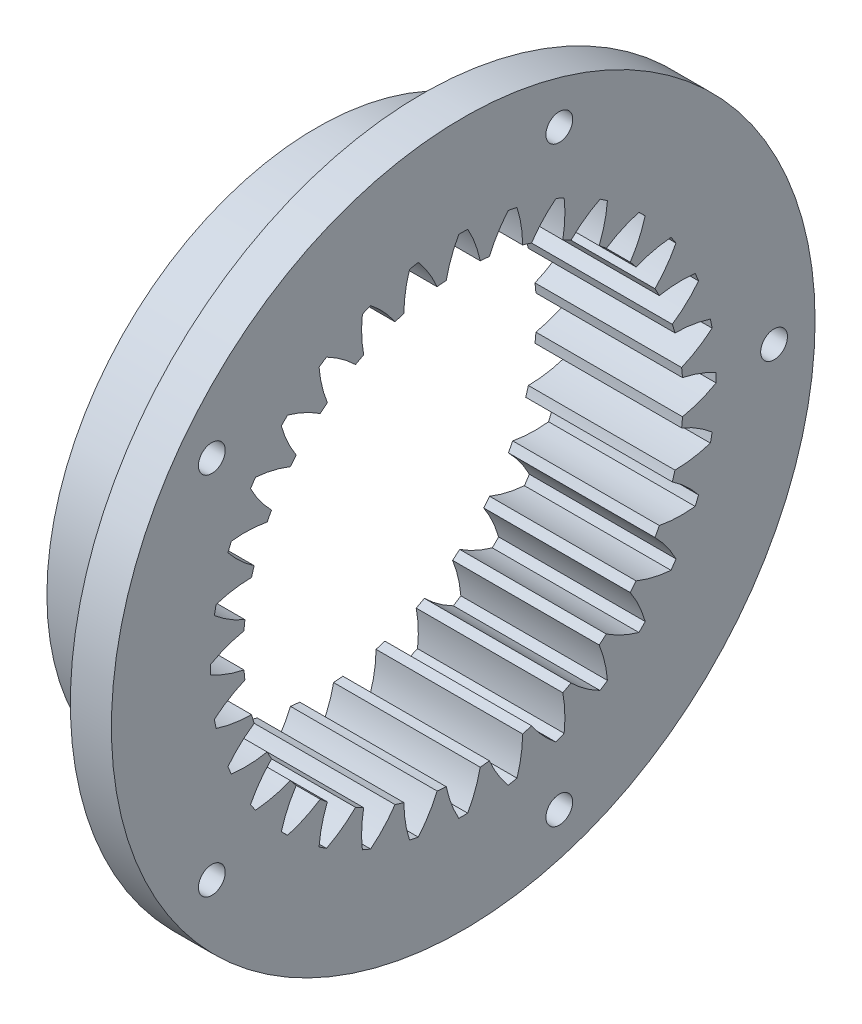
from build123d import *

# Parameters (mm, degrees)
BASPROSKE_W                             = 31.75
BASPROSKE_H                             = 7.17042
TOOTHCUT_DEPTH                          = 84.744484033
TEETHCUTS_COUNT                         = 32
TEETHCUTS_ANGLE                         = 348.75
BOSS_EXTRUDE2_START                     = 31.75
SKETCH1_R                               = 58.42
SKETCH1_R_2                             = 54.79542
BOSS_EXTRUDE2_DEPTH                     = 31.75
SKETCH3_R                               = 76.2
SKETCH3_R_2                             = 58.42
BOSS_EXTRUDE4_DEPTH                     = 8.89
CBORE_FOR_M5_HEX_HEAD_BOLT2_D           = 5.8
CBORE_FOR_M5_HEX_HEAD_BOLT2_CBORE_D     = 12.24
CBORE_FOR_M5_HEX_HEAD_BOLT2_CBORE_DEPTH = 3.58
CIRPATTERN1_COUNT                       = 5


with BuildPart() as part:
    # BasProSke → Base-Revolve (revolve)
    with BuildSketch(Plane(origin=(0, 0, 0), x_dir=(1, 0, 0), z_dir=(0, 1, 0)), mode=Mode.PRIVATE) as base_revolve_sk:
        with Locations((15.875, 51.21021)):
            Rectangle(BASPROSKE_W, BASPROSKE_H)
    revolve(base_revolve_sk.sketch.rotate(Axis((-10, 0, 0), (1, 0, 0)), 180), axis=Axis((-10, 0, 0), (1, 0, 0)))

    # TooCutSke → ToothCut (cut, through all)
    with BuildSketch(Plane(origin=(0, 0, 0), x_dir=(0, 0, -1), z_dir=(1, 0, 0))):
        with BuildLine():
            ThreePointArc((3.674109851, 47.457589877), (2.602534439, 51.213892195), (0.967674745, 54.761470911))
            ThreePointArc((0.967674745, 54.761470911), (0, 54.77002), (-0.967674745, 54.761470911))
            ThreePointArc((-0.967674745, 54.761470911), (-2.602534439, 51.213892195), (-3.674109851, 47.457589877))
            ThreePointArc((-3.674109851, 47.457589877), (0, 47.5996), (3.674109851, 47.457589877))
        make_face()
    toothcut = extrude(amount=TOOTHCUT_DEPTH, mode=Mode.SUBTRACT)

    # TeethCuts: ToothCut ×32 about axis
    teethcuts_axis = Axis((-10, 0, 0), (1, 0, 0))
    for i in range(1, TEETHCUTS_COUNT):
        add(toothcut.rotate(teethcuts_axis, i * TEETHCUTS_ANGLE / (TEETHCUTS_COUNT - 1)), mode=Mode.SUBTRACT)

    # Sketch1 → Boss-Extrude2 (add)
    with BuildSketch(Plane(origin=(0, 0, 0), x_dir=(0, 0, -1), z_dir=(1, 0, 0)).offset(BOSS_EXTRUDE2_START)):
        with Locations(Location((0, 0, 0), (0, 0, 180))):
            Circle(SKETCH1_R)
        Circle(SKETCH1_R_2, mode=Mode.SUBTRACT)
    extrude(amount=-BOSS_EXTRUDE2_DEPTH)

    # Sketch3 → Boss-Extrude4 (add)
    with BuildSketch(Plane(origin=(31.75, 0, 0), x_dir=(0, 0, -1), z_dir=(1, 0, 0))):
        Circle(SKETCH3_R)
        Circle(SKETCH3_R_2, mode=Mode.SUBTRACT)
    extrude(amount=-BOSS_EXTRUDE4_DEPTH)

    # CBORE for M5 Hex Head Bolt2 (through all)
    with Locations(Plane(origin=(22.86, 0, -67.31), x_dir=(0, 0, -1), z_dir=(-1, 0, 0))):
        with Locations((0, 0)):
            cbore_for_m5_hex_head_bolt2 = CounterBoreHole(CBORE_FOR_M5_HEX_HEAD_BOLT2_D / 2, CBORE_FOR_M5_HEX_HEAD_BOLT2_CBORE_D / 2, CBORE_FOR_M5_HEX_HEAD_BOLT2_CBORE_DEPTH)

    # CirPattern1: CBORE for M5 Hex Head Bolt2 ×5 about axis
    cirpattern1_axis = Axis((0, 0, 0), (1, 0, 0))
    for i in range(1, CIRPATTERN1_COUNT):
        add(cbore_for_m5_hex_head_bolt2.rotate(cirpattern1_axis, i * 360 / CIRPATTERN1_COUNT), mode=Mode.SUBTRACT)


solid = part.part
